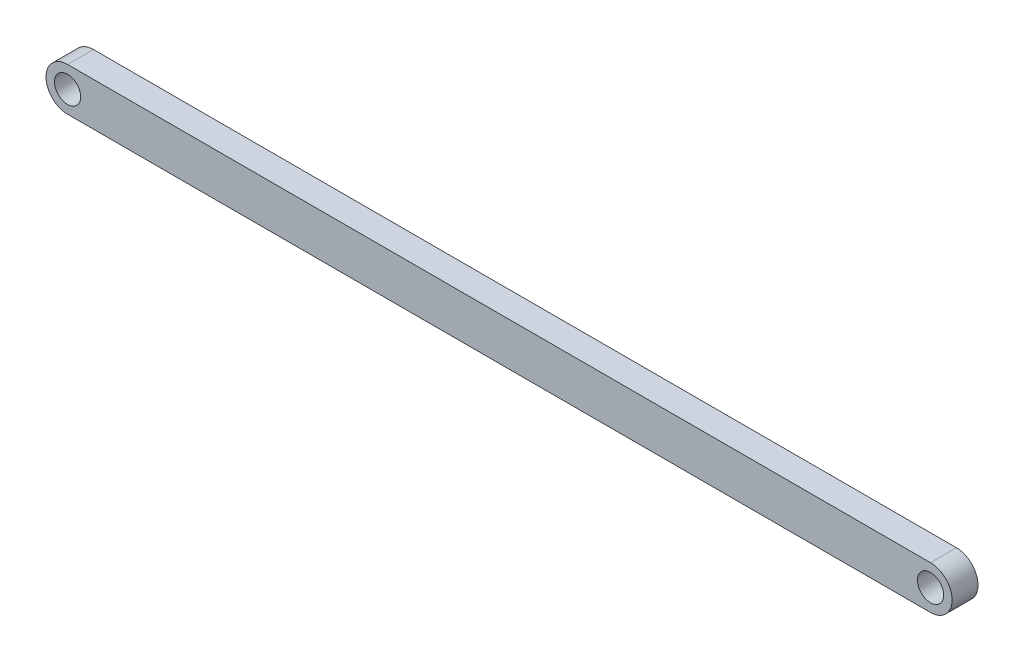
from build123d import *

# Parameters (mm, degrees)
ESQUISSE1_R        = 7.6
BOSS_EXTRU_1_DEPTH = 15


with BuildPart() as part:
    # Esquisse1 → Boss.-Extru.1 (new body)
    with BuildSketch(Plane.XY):
        with BuildLine():
            Line((-76.206124365, 12.5), (423.793875635, 12.5))
            ThreePointArc((423.793875635, 12.5), (436.293875635, 0), (423.793875635, -12.5))
            Line((423.793875635, -12.5), (-76.206124365, -12.5))
            ThreePointArc((-76.206124365, -12.5), (-88.706124365, 0), (-76.206124365, 12.5))
        make_face()
        with Locations((-76.206124365, 0)):
            Circle(ESQUISSE1_R, mode=Mode.SUBTRACT)
        with Locations((423.793875635, 0)):
            Circle(ESQUISSE1_R, mode=Mode.SUBTRACT)
    extrude(amount=BOSS_EXTRU_1_DEPTH)


solid = part.part
